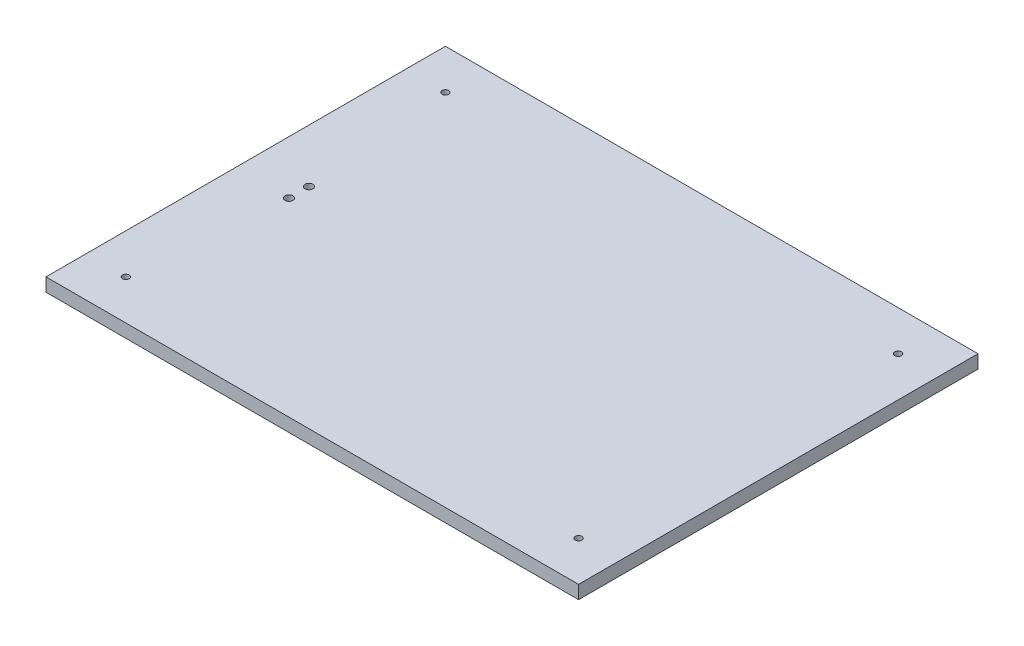
from build123d import *

# Parameters (mm, degrees)
BASEPLATE_W         = 400
BASEPLATE_H         = 300
BASEPLATE_R         = 3
BASEPLATE_R_2       = 2.5
BOSS_EXTRUDE1_DEPTH = 10


with BuildPart() as part:
    # BasePlate → Boss-Extrude1 (new body)
    with BuildSketch(Plane(origin=(0, 0, 0), x_dir=(1, 0, 0), z_dir=(0, 1, 0))):
        Rectangle(BASEPLATE_W, BASEPLATE_H)
        with Locations(Location((-160, 7.5, 0), (0, 0, 270))):
            Circle(BASEPLATE_R, mode=Mode.SUBTRACT)
        with Locations(Location((-160, -7.5, 0), (0, 0, 270))):
            Circle(BASEPLATE_R, mode=Mode.SUBTRACT)
        with Locations(Location((-170, 120, 0), (0, 0, 270))):
            Circle(BASEPLATE_R_2, mode=Mode.SUBTRACT)
        with Locations(Location((170, 120, 0), (0, 0, 270))):
            Circle(BASEPLATE_R_2, mode=Mode.SUBTRACT)
        with Locations(Location((170, -120, 0), (0, 0, 270))):
            Circle(BASEPLATE_R_2, mode=Mode.SUBTRACT)
        with Locations(Location((-170, -120, 0), (0, 0, 270))):
            Circle(BASEPLATE_R_2, mode=Mode.SUBTRACT)
    extrude(amount=BOSS_EXTRUDE1_DEPTH)


solid = part.part
